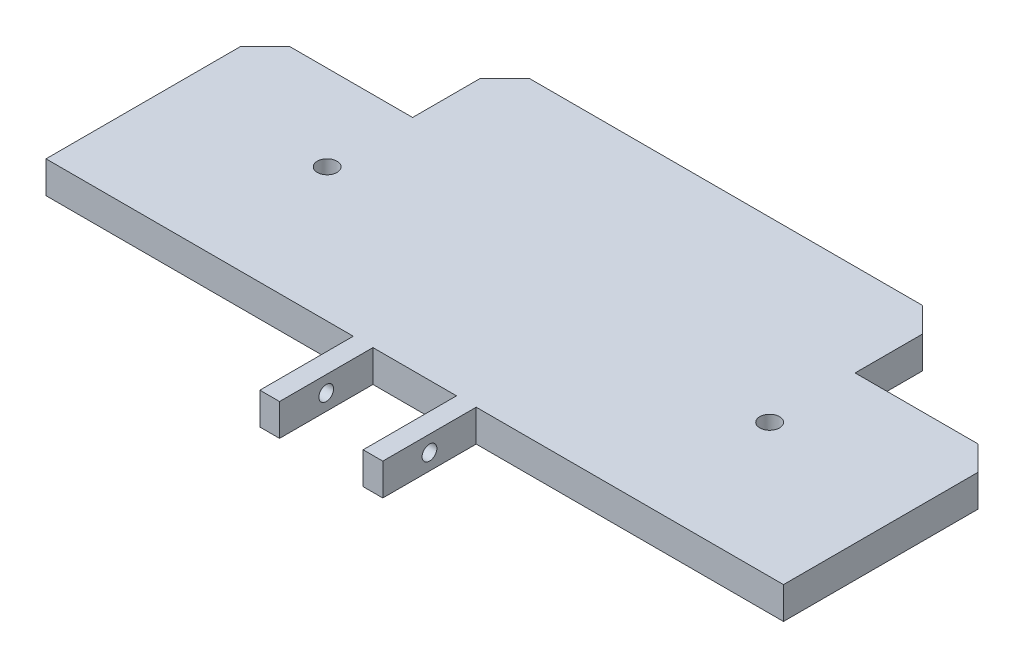
from build123d import *

# Parameters (mm, degrees)
SKETCH1_W           = 150
SKETCH1_H           = 63.315
BOSS_EXTRUDE1_DEPTH = 6.5
SKETCH2_W           = 4
SKETCH2_H           = 6.5
BOSS_EXTRUDE2_DEPTH = 19
SKETCH3_W           = 30
SKETCH3_H           = 6.5
CUT_EXTRUDE1_DEPTH  = 18.75
CHAMFER1_SIZE       = 5
SKETCH5_R           = 5
BOSS_EXTRUDE3_DEPTH = 17.5
FILLET1_R           = 5
SKETCH6_R           = 3.5
CUT_EXTRUDE2_DEPTH  = 17.5
SKETCH7_R           = 3.5
CUT_EXTRUDE3_DEPTH  = 17.5
SKETCH8_R           = 2
CUT_EXTRUDE4_DEPTH  = 6.5
SKETCH9_R           = 1.5
CUT_EXTRUDE5_DEPTH  = 25


with BuildPart() as part:
    # Sketch1 → Boss-Extrude1 (new body)
    with BuildSketch(Plane(origin=(0, 0, 0), x_dir=(1, 0, 0), z_dir=(0, 1, 0))):
        Rectangle(SKETCH1_W, SKETCH1_H)
    extrude(amount=BOSS_EXTRUDE1_DEPTH)

    # Sketch2 → Boss-Extrude2 (add)
    with BuildSketch(Plane.XY.offset(31.6575)):
        with Locations((-10.5, 3.25)):
            Rectangle(SKETCH2_W, SKETCH2_H)
        with Locations((10.5, 3.25)):
            Rectangle(SKETCH2_W, SKETCH2_H)
    extrude(amount=BOSS_EXTRUDE2_DEPTH)

    # Sketch3 → Cut-Extrude1 (cut)
    with BuildSketch(Plane(origin=(0, 0, -31.6575), x_dir=(-1, 0, 0), z_dir=(0, 0, -1))):
        with Locations((-60, 3.25)):
            Rectangle(SKETCH3_W, SKETCH3_H)
        with Locations((60, 3.25)):
            Rectangle(SKETCH3_W, SKETCH3_H)
    extrude(amount=-CUT_EXTRUDE1_DEPTH, mode=Mode.SUBTRACT)

    # Chamfer1
    chamfer1_edges = [part.edges().sort_by_distance(p)[0] for p in [
        (75, 3.25, -12.9075),
        (45, 3.25, -31.6575),
        (-75, 3.25, -12.9075),
        (-45, 3.25, -31.6575),
    ]]
    chamfer(chamfer1_edges, length=CHAMFER1_SIZE)

    # Sketch5 → Boss-Extrude3 (add)
    with BuildSketch(Plane.XZ):
        with Locations(Location((45, 4.4725, 0), (0, 0, 90))):
            Circle(SKETCH5_R)
        with Locations(Location((-45, 4.4725, 0), (0, 0, 90))):
            Circle(SKETCH5_R)
    extrude(amount=BOSS_EXTRUDE3_DEPTH)

    # Fillet1
    fillet1_edges = [part.edges().sort_by_distance(p)[0] for p in [
        (-45, 0, -0.5275),
        (45, 0, -0.5275),
    ]]
    fillet(fillet1_edges, radius=FILLET1_R)

    # Sketch6 → Cut-Extrude2 (cut)
    with BuildSketch(Plane.XZ.offset(17.5)):
        with Locations(Location((45, 4.4725, 0), (0, 0, 270))):
            Circle(SKETCH6_R)
    extrude(amount=-CUT_EXTRUDE2_DEPTH, mode=Mode.SUBTRACT)

    # Sketch7 → Cut-Extrude3 (cut)
    with BuildSketch(Plane.XZ.offset(17.5)):
        with Locations(Location((-45, 4.4725, 0), (0, 0, 270))):
            Circle(SKETCH7_R)
    extrude(amount=-CUT_EXTRUDE3_DEPTH, mode=Mode.SUBTRACT)

    # Sketch8 → Cut-Extrude4 (cut)
    with BuildSketch(Plane.XZ):
        with Locations(Location((45, 4.4725, 0), (0, 0, 270))):
            Circle(SKETCH8_R)
        with Locations(Location((-45, 4.4725, 0), (0, 0, 270))):
            Circle(SKETCH8_R)
    extrude(amount=-CUT_EXTRUDE4_DEPTH, mode=Mode.SUBTRACT)

    # Sketch9 → Cut-Extrude5 (cut)
    with BuildSketch(Plane.ZY.offset(12.5)):
        with Locations((41.1575, 3.25)):
            Circle(SKETCH9_R)
    extrude(amount=-CUT_EXTRUDE5_DEPTH, mode=Mode.SUBTRACT)


solid = part.part
